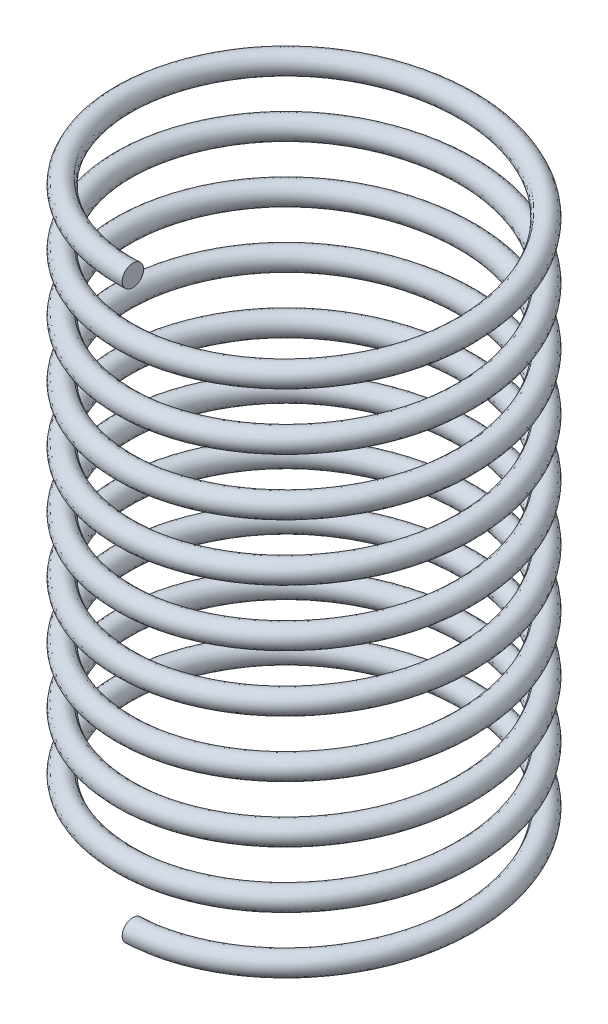
from build123d import *

# Parameters (mm, degrees)
SWEEP1_PITCH  = 0.53
SWEEP1_HEIGHT = 5.3
SWEEP1_RADIUS = 1.6
SKETCH3_R     = 0.1


with BuildPart() as part:
    # Sweep1: sweep along a helix
    with BuildLine() as sweep1_path:
        Helix(SWEEP1_PITCH, SWEEP1_HEIGHT, SWEEP1_RADIUS, center=(0, 0, 0), direction=(0, 1, 0))
    # Sketch3 → Sweep1 (sweep)
    with BuildSketch(Plane(origin=(0, 0, 0), x_dir=(0, 0, -1), z_dir=(1, 0, 0))):
        with Locations((-1.6, 0)):
            Circle(SKETCH3_R)
    sweep(path=sweep1_path.line, is_frenet=True)


solid = part.part
